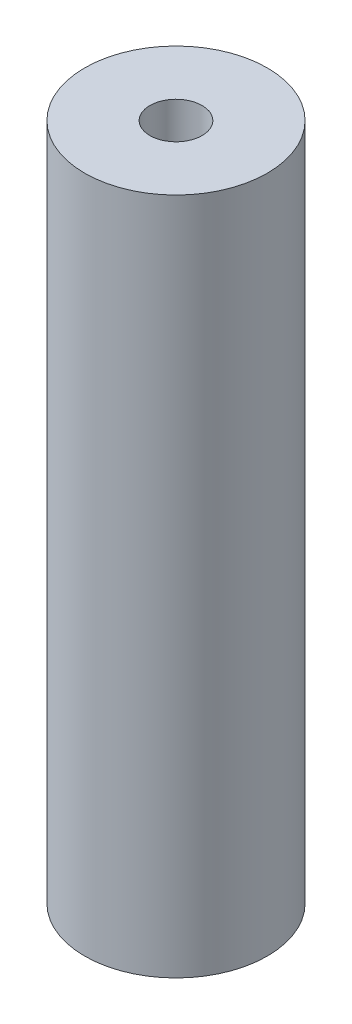
from build123d import *

# Parameters (mm, degrees)
SKETCH1_R           = 8.75
BOSS_EXTRUDE1_DEPTH = 65
SKETCH2_R           = 2.5
CUT_EXTRUDE1_DEPTH  = 131


with BuildPart() as part:
    # Sketch1 → Boss-Extrude1 (new body)
    with BuildSketch(Plane(origin=(0, 0, 0), x_dir=(1, 0, 0), z_dir=(0, 1, 0))):
        with Locations(Location((0, 0, 0), (0, 0, 270))):
            Circle(SKETCH1_R)
    extrude(amount=BOSS_EXTRUDE1_DEPTH)

    # Sketch2 → Cut-Extrude1 (cut)
    with BuildSketch(Plane(origin=(0, 0, 0), x_dir=(1, 0, 0), z_dir=(0, 1, 0))):
        with Locations(Location((0, 0, 0), (0, 0, 270))):
            Circle(SKETCH2_R)
    extrude(amount=CUT_EXTRUDE1_DEPTH, mode=Mode.SUBTRACT)


solid = part.part
